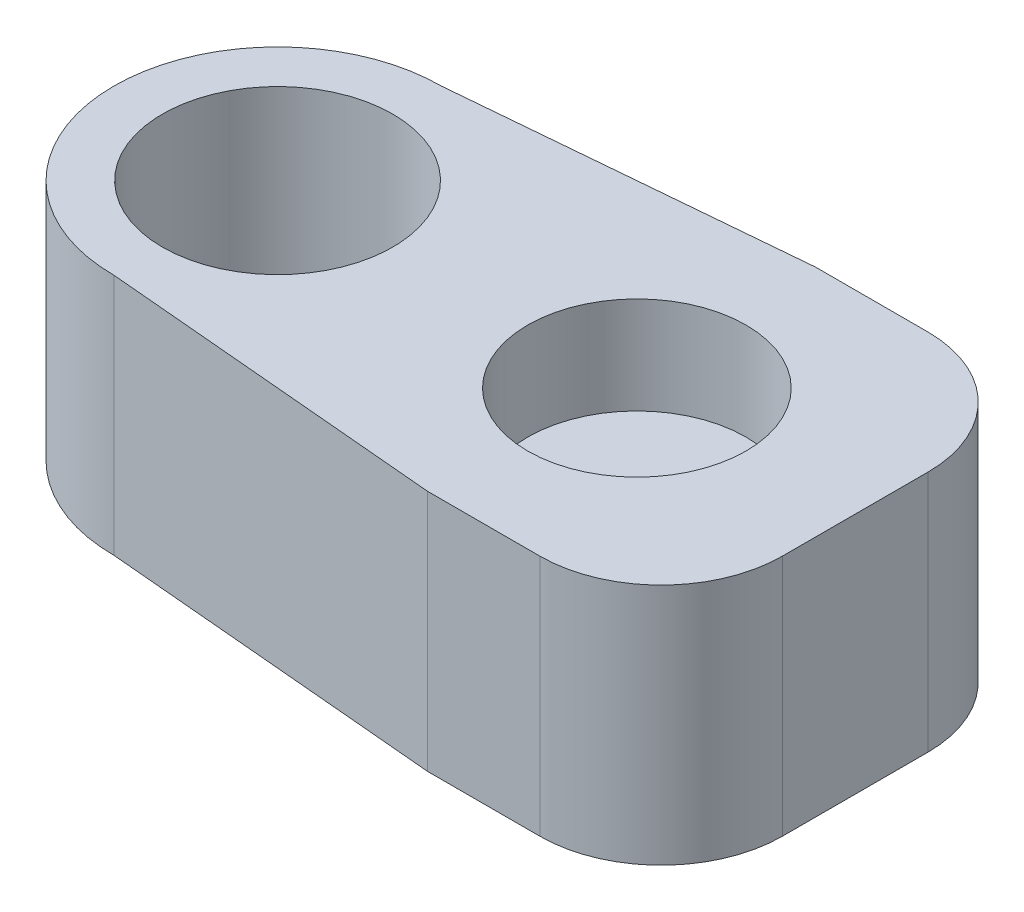
from build123d import *

# Parameters (mm, degrees)
SKETCH1_R           = 4.75
BOSS_EXTRUDE1_DEPTH = 10
SKETCH2_R           = 4.5
CUT_EXTRUDE1_DEPTH  = 4
CUT_EXTRUDE2_START  = -4
SKETCH4_R           = 4.5
CUT_EXTRUDE2_DEPTH  = 4


with BuildPart() as part:
    # Sketch1 → Boss-Extrude1 (new body)
    with BuildSketch(Plane(origin=(0, 0, 0), x_dir=(1, 0, 0), z_dir=(0, 1, 0))):
        with BuildLine():
            Line((5.649139951, 8), (10.28, 8))
            ThreePointArc((10.28, 8), (13.815533906, 6.535533906), (15.28, 3))
            Line((15.28, 3), (15.28, -3))
            ThreePointArc((15.28, -3), (13.815533906, -6.535533906), (10.28, -8))
            Line((10.28, -8), (5.649139951, -8))
            Line((5.649139951, -8), (-8.529960299, -6.75))
            ThreePointArc((-8.529960299, -6.75), (-13.302950922, -4.772978995), (-15.28, 0))
            ThreePointArc((-15.28, 0), (-13.302950922, 4.772978995), (-8.529960299, 6.75))
            Line((-8.529960299, 6.75), (5.649139951, 8))
        make_face()
        with Locations(Location((-8.529960299, 0, 0), (0, 0, 270))):
            Circle(SKETCH1_R, mode=Mode.SUBTRACT)
    extrude(amount=BOSS_EXTRUDE1_DEPTH)

    # Sketch2 → Cut-Extrude1 (cut)
    with BuildSketch(Plane(origin=(0, 10, 0), x_dir=(1, 0, 0), z_dir=(0, 1, 0))):
        with Locations(Location((6.280039701, 0, 0), (0, 0, 270))):
            Circle(SKETCH2_R)
    extrude(amount=-CUT_EXTRUDE1_DEPTH, mode=Mode.SUBTRACT)

    # Sketch4 → Cut-Extrude2 (cut)
    with BuildSketch(Plane.XZ.offset(CUT_EXTRUDE2_START)):
        with Locations(Location((6.280039701, 0, 0), (0, 0, 90))):
            Circle(SKETCH4_R)
    extrude(amount=CUT_EXTRUDE2_DEPTH, mode=Mode.SUBTRACT)


solid = part.part
